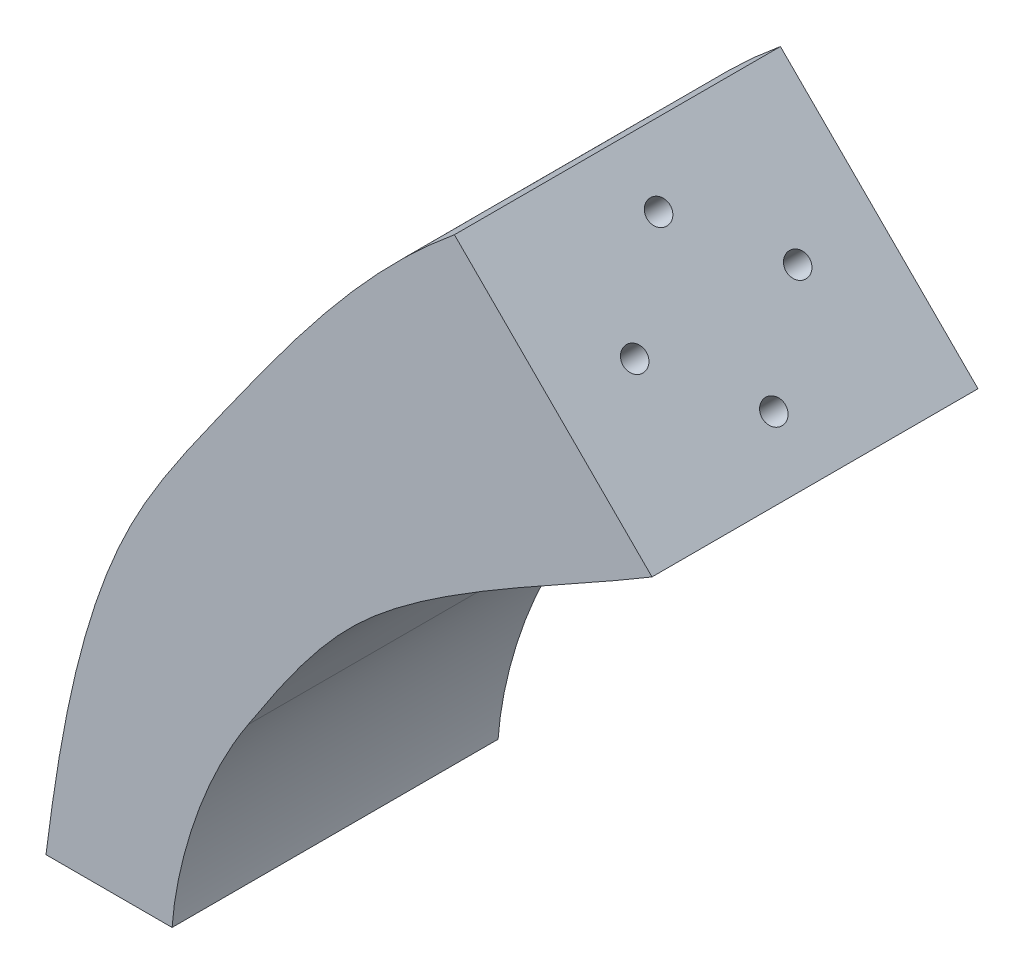
from build123d import *

# Parameters (mm, degrees)
BOSS_EXTRUDE1_DEPTH = 28
SKETCH2_R           = 1
CUT_EXTRUDE1_DEPTH  = 8


with BuildPart() as part:
    # Sketch1 → Boss-Extrude1 (new body)
    with BuildSketch(Plane.XY):
        with BuildLine():
            Line((2.091427576, 20.661862086), (19.061990324, 3.691299338))
            add(Edge.make_bspline(
                [(19.061990324, 3.691299338), (12.746216472, -0.109381504), (3.690052204, -4.556022811), (-8.472746201, -13.766338541), (-12.879485208, -20.395145485), (-15.628608368, -24.633897386)],
                knots=[0, 0, 0, 0, 0.486352052, 0.663536936, 1, 1, 1, 1], degree=3))
            add(Edge.make_bspline(
                [(-15.628608368, -24.633897386), (-20.139825212, -31.511110603), (-21.892637983, -38.928427503), (-22.158270614, -42.992769069)],
                knots=[0, 0, 0, 0, 1, 1, 1, 1], degree=3))
            Line((-22.158270614, -42.992769069), (-32.987873718, -42.992769069))
            add(Edge.make_bspline(
                [(2.091427576, 20.661862086), (-6.15306444, 13.902564566), (-14.885859474, 1.614168074), (-29.29473419, -18.775684606), (-31.797796149, -33.536211334), (-32.987873718, -42.992769069)],
                knots=[0, 0, 0, 0, 0.424008196, 0.607838578, 1, 1, 1, 1], degree=3))
        make_face()
    extrude(amount=BOSS_EXTRUDE1_DEPTH)

    # Sketch2 → Cut-Extrude1 (cut)
    with BuildSketch(Plane(origin=(11.376644831, 11.376644831, 0), x_dir=(0, 0, -1), z_dir=(0.7071067811865388, 0.7071067811865562, 0))):
        with Locations(Location((-7, 1.131280172, 0), (0, 0, 90))):
            Circle(SKETCH2_R)
        with Locations(Location((-14, 8.131280172, 0), (0, 0, 270))):
            Circle(SKETCH2_R)
        with Locations(Location((-14, -5.868719828, 0), (0, 0, 90))):
            Circle(SKETCH2_R)
        with Locations(Location((-21, 1.131280172, 0), (0, 0, 270))):
            Circle(SKETCH2_R)
    extrude(amount=-CUT_EXTRUDE1_DEPTH, mode=Mode.SUBTRACT)


solid = part.part
